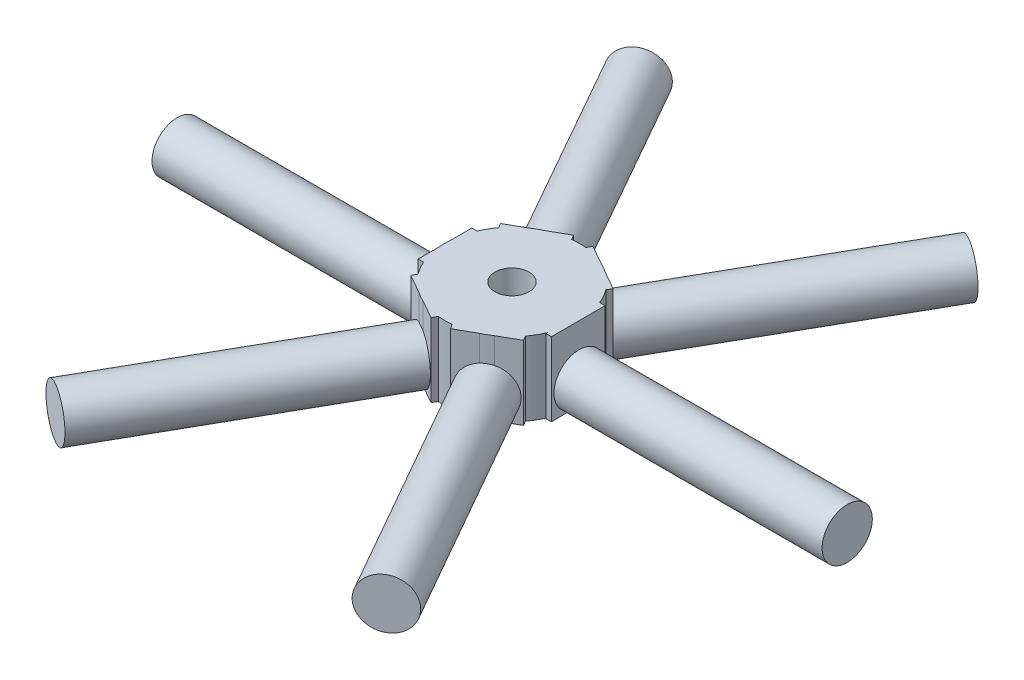
from build123d import *

# Parameters (mm, degrees)
SKETCH1_R                = 12.7
SKETCH1_R_2              = 3.2385
BOSS_EXTRUDE1_DEPTH      = 19.05
SKETCH4_W                = 1.016
SKETCH4_H                = 10.16
BOSS_EXTRUDE2_DEPTH      = 19.05
CUT_EXTRUDE1_DEPTH       = 37.389507521
CUT_EXTRUDE1_DEPTH_BACK  = 37.389507521
SKETCH8_R                = 2.921
CUT_EXTRUDE2_DEPTH       = 39.543446664
CUT_EXTRUDE2_DEPTH_BACK  = 39.543446664
SKETCH9_R                = 2.921
CUT_EXTRUDE3_DEPTH       = 39.543446664
CUT_EXTRUDE3_DEPTH_BACK  = 39.543446664
SKETCH10_R               = 2.921
SKETCH12_R               = 23.401643017
CUT_EXTRUDE4_DEPTH       = 5.08
BOSS_EXTRUDE3_DEPTH      = 48.26
BOSS_EXTRUDE3_DEPTH_BACK = 2.54
SKETCH14_R               = 4.7625
BOSS_EXTRUDE4_DEPTH      = 48.26
BOSS_EXTRUDE4_DEPTH_BACK = 2.54
SKETCH15_R               = 4.7625
BOSS_EXTRUDE5_DEPTH      = 48.26
BOSS_EXTRUDE5_DEPTH_BACK = 2.54
SKETCH16_R               = 4.7625
BOSS_EXTRUDE6_DEPTH      = 48.26
BOSS_EXTRUDE6_DEPTH_BACK = 2.54
SKETCH17_R               = 4.7625
SKETCH18_R               = 4.7625
BOSS_EXTRUDE7_DEPTH      = 50.8
SKETCH19_R               = 4.7625
BOSS_EXTRUDE8_DEPTH      = 50.8


with BuildPart() as part:
    # Sketch1 → Boss-Extrude1 (new body)
    with BuildSketch(Plane(origin=(0, 0, 0), x_dir=(1, 0, 0), z_dir=(0, 1, 0))):
        Circle(SKETCH1_R)
        Circle(SKETCH1_R_2, mode=Mode.SUBTRACT)
    extrude(amount=BOSS_EXTRUDE1_DEPTH)

    # Sketch4 → Boss-Extrude2 (add)
    with BuildSketch(Plane(origin=(0, 0, 0), x_dir=(1, 0, 0), z_dir=(0, 1, 0))):
        with Locations((12.218261251, -0.164739944)):
            Rectangle(SKETCH4_W, SKETCH4_H)
        with Locations((-12.129900524, -0.040686304)):
            Rectangle(SKETCH4_W, SKETCH4_H)
        Polygon((-10.661103505, 8.503827629), (-10.16, 7.62), (-1.321723713, 12.63103505), (-1.822827218, 13.514862678), align=None)
        Polygon((1.840434939, 13.512476143), (1.338180271, 12.62930218), (10.169919899, 7.606755501), (10.672174567, 8.489929463), align=None)
        Polygon((-1.321723713, -12.63103505), (-10.16, -7.62), (-10.661103505, -8.503827629), (-1.822827218, -13.514862678), align=None)
        Polygon((10.169919899, -7.606755501), (1.338180271, -12.62930218), (1.840434939, -13.512476143), (10.672174567, -8.489929463), align=None)
    extrude(amount=BOSS_EXTRUDE2_DEPTH)

    # Sketch8 → Cut-Extrude1 (cut, two sides: drawn at the far end of the back side and taken through both)
    with BuildSketch(Plane.ZY.offset(15.177900524).offset(-CUT_EXTRUDE1_DEPTH_BACK)):
        with Locations((0, 9.525)):
            Circle(SKETCH8_R)
    extrude(amount=CUT_EXTRUDE1_DEPTH + CUT_EXTRUDE1_DEPTH_BACK, mode=Mode.SUBTRACT)

    # Sketch9 → Cut-Extrude2 (cut, two sides: drawn at the far end of the back side and taken through both)
    with BuildSketch(Plane(origin=(7.511941423, 0, -13.20913771), x_dir=(-0.8692657113802013, 0, -0.49434514564084964), z_dir=(0.49434514564084964, 0, -0.8692657113802013)).offset(-CUT_EXTRUDE2_DEPTH_BACK)):
        with Locations((0, 9.525)):
            Circle(SKETCH9_R)
    extrude(amount=CUT_EXTRUDE2_DEPTH + CUT_EXTRUDE2_DEPTH_BACK, mode=Mode.SUBTRACT)

    # Sketch10 → Cut-Extrude3 (cut, two sides: drawn at the far end of the back side and taken through both)
    with BuildSketch(Plane(origin=(7.511941423, 0, 13.20913771), x_dir=(0.8692657113802004, 0, -0.494345145640851), z_dir=(0.494345145640851, 0, 0.8692657113802004)).offset(-CUT_EXTRUDE3_DEPTH_BACK)):
        with Locations((0, 9.525)):
            Circle(SKETCH10_R)
    extrude(amount=CUT_EXTRUDE3_DEPTH + CUT_EXTRUDE3_DEPTH_BACK, mode=Mode.SUBTRACT)

    # Sketch12 → Cut-Extrude4 (cut)
    with BuildSketch(Plane(origin=(0, 0, 0), x_dir=(1, 0, 0), z_dir=(0, 1, 0))):
        Circle(SKETCH12_R)
    extrude(amount=CUT_EXTRUDE4_DEPTH, mode=Mode.SUBTRACT)

    # Sketch14 → Boss-Extrude3 (add, two sides: drawn at the far end of the back side and taken through both)
    with BuildSketch(Plane(origin=(15.266261251, 0, 0), x_dir=(0, 0, -1), z_dir=(1, 0, 0)).offset(-BOSS_EXTRUDE3_DEPTH_BACK)):
        with Locations((0, 9.525)):
            Circle(SKETCH14_R)
    extrude(amount=BOSS_EXTRUDE3_DEPTH + BOSS_EXTRUDE3_DEPTH_BACK)

    # Sketch15 → Boss-Extrude4 (add, two sides: drawn at the far end of the back side and taken through both)
    with BuildSketch(Plane(origin=(7.511941423, 0, 13.20913771), x_dir=(0.8692657113802004, 0, -0.494345145640851), z_dir=(0.494345145640851, 0, 0.8692657113802004)).offset(-BOSS_EXTRUDE4_DEPTH_BACK)):
        with Locations((0, 9.525)):
            Circle(SKETCH15_R)
    extrude(amount=BOSS_EXTRUDE4_DEPTH + BOSS_EXTRUDE4_DEPTH_BACK)

    # Sketch16 → Boss-Extrude5 (add, two sides: drawn at the far end of the back side and taken through both)
    with BuildSketch(Plane.ZY.offset(15.177900524).offset(-BOSS_EXTRUDE5_DEPTH_BACK)):
        with Locations((0, 9.525)):
            Circle(SKETCH16_R)
    extrude(amount=BOSS_EXTRUDE5_DEPTH + BOSS_EXTRUDE5_DEPTH_BACK)

    # Sketch17 → Boss-Extrude6 (add, two sides: drawn at the far end of the back side and taken through both)
    with BuildSketch(Plane(origin=(7.511941423, 0, -13.20913771), x_dir=(-0.8692657113802013, 0, -0.49434514564084964), z_dir=(0.49434514564084964, 0, -0.8692657113802013)).offset(-BOSS_EXTRUDE6_DEPTH_BACK)):
        with Locations((0, 9.525)):
            Circle(SKETCH17_R)
    extrude(amount=BOSS_EXTRUDE6_DEPTH + BOSS_EXTRUDE6_DEPTH_BACK)

    # Sketch18 → Boss-Extrude7 (add)
    with BuildSketch(Plane(origin=(-6.241965361, 0, -11.009345154), x_dir=(-0.8699090833946802, 0, 0.4932121111929708), z_dir=(-0.4932121111929708, 0, -0.8699090833946802))):
        with Locations((0, 9.525)):
            Circle(SKETCH18_R)
    extrude(amount=BOSS_EXTRUDE7_DEPTH)

    # Sketch19 → Boss-Extrude8 (add)
    with BuildSketch(Plane(origin=(-6.241965361, 0, 11.009345154), x_dir=(0.8699090833947006, 0, 0.4932121111929346), z_dir=(-0.4932121111929346, 0, 0.8699090833947006))):
        with Locations((0, 9.525)):
            Circle(SKETCH19_R)
    extrude(amount=BOSS_EXTRUDE8_DEPTH)


solid = part.part
